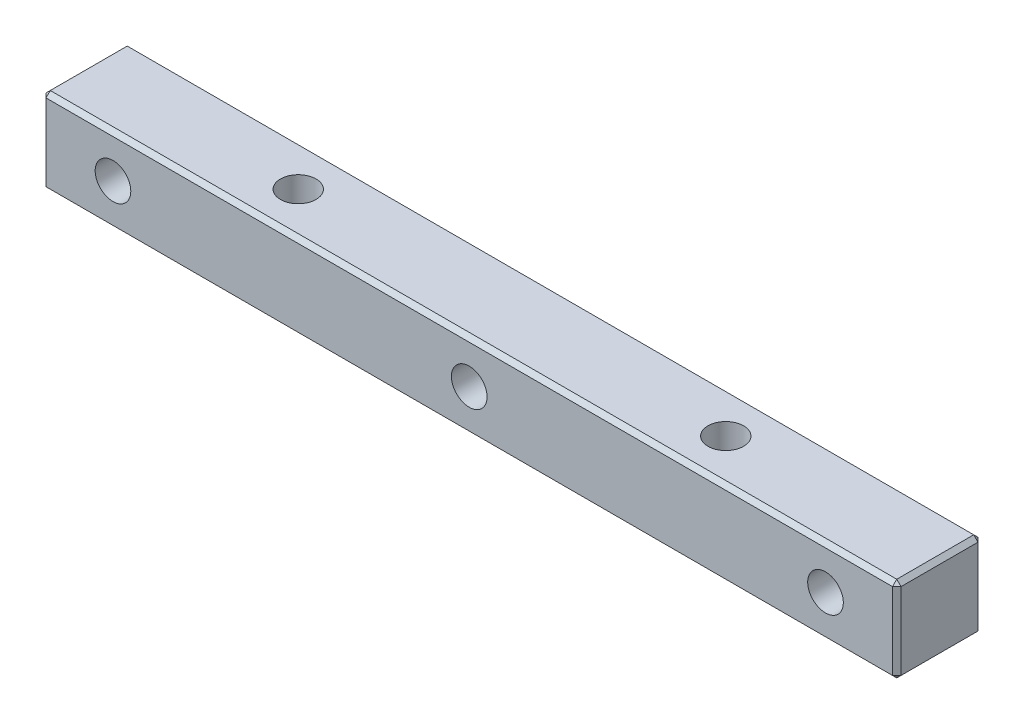
from build123d import *

# Parameters (mm, degrees)
SKETCH_1_W         = 60
SKETCH_1_H         = 6
EXTRUDE_1_DEPTH    = 3
HOLE_WIZARD_M3_1_D = 2.5
HOLE_WIZARD_M3_2_D = 2.5
CHAMFER_1_SIZE     = 0.3


with BuildPart() as part:
    # 草图1 → 凸台-拉伸1 (new, symmetric)
    with BuildSketch(Plane.XY):
        Rectangle(SKETCH_1_W, SKETCH_1_H)
    extrude(amount=EXTRUDE_1_DEPTH, both=True)

    # M3 螺纹孔1 (through all)
    with Locations(Plane.XY.offset(3)):
        with Locations((-25, 0), (0, 0), (25, 0)):
            Hole(HOLE_WIZARD_M3_1_D / 2)

    # M3 螺纹孔2 (through all)
    with Locations(Plane(origin=(0, 3, 0), x_dir=(1, 0, 0), z_dir=(0, 1, 0))):
        with Locations((-15, 0), (15, 0)):
            Hole(HOLE_WIZARD_M3_2_D / 2)

    # 倒角1
    chamfer_1_edges = [part.edges().sort_by_distance(p)[0] for p in [
        (-30, 0, 3),
        (0, -3, 3),
        (30, 0, 3),
        (0, -3, -3),
        (-30, 0, -3),
        (0, 3, -3),
        (30, 0, -3),
        (30, -3, 0),
        (-30, -3, 0),
        (-30, 3, 0),
        (30, 3, 0),
        (0, 3, 3),
    ]]
    chamfer(chamfer_1_edges, length=CHAMFER_1_SIZE)


solid = part.part
